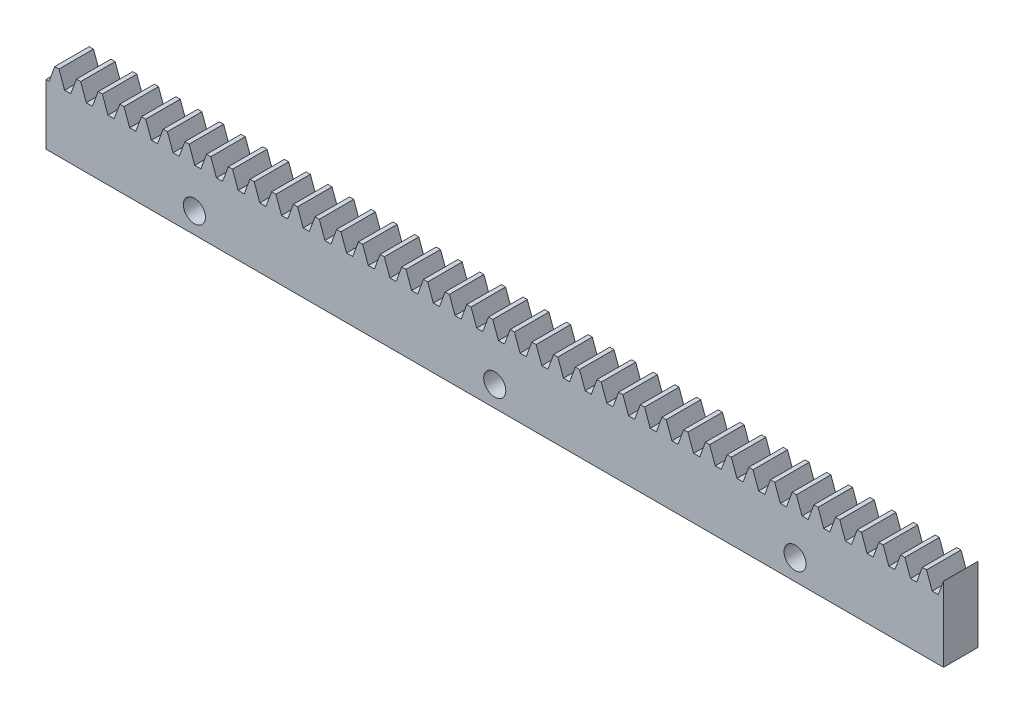
from build123d import *

# Parameters (mm, degrees)
BLANKSKE_W              = 130
BLANKSKE_H              = 11
BLANK_DEPTH             = 5
TOOTHCUTSIM_DEPTH       = 131.560330882
TEETHCUTS_COUNT         = 42
TEETHCUTS_PITCH         = 3.14159265
ESQUISSE1_R             = 1.6
ENL_V_MAT_EXTRU_1_DEPTH = 10


with BuildPart() as part:
    # BlankSke → Blank (new body)
    with BuildSketch(Plane.XY):
        with Locations((65, 5.5)):
            Rectangle(BLANKSKE_W, BLANKSKE_H)
    extrude(amount=-BLANK_DEPTH)

    # TooCutSkeSim → ToothCutSim (cut, through all)
    with BuildSketch(Plane.XY):
        Polygon((0.44443537, 8.75), (-0.44443537, 8.75), (-1.272613241, 11.0254), (1.272613241, 11.0254), align=None)
    toothcutsim = extrude(amount=-TOOTHCUTSIM_DEPTH, mode=Mode.SUBTRACT)

    # TeethCuts: ToothCutSim ×42
    with Locations(*[(i * TEETHCUTS_PITCH, 0, 0) for i in range(1, TEETHCUTS_COUNT)]):
        add(toothcutsim, mode=Mode.SUBTRACT)

    # Esquisse1 → Enlèv. mat.-Extru.1 (cut)
    with BuildSketch(Plane.XY):
        with Locations((21.5, 3)):
            Circle(ESQUISSE1_R)
        with Locations((65, 3)):
            Circle(ESQUISSE1_R)
        with Locations((108.5, 3)):
            Circle(ESQUISSE1_R)
    extrude(amount=-ENL_V_MAT_EXTRU_1_DEPTH, mode=Mode.SUBTRACT)


solid = part.part
